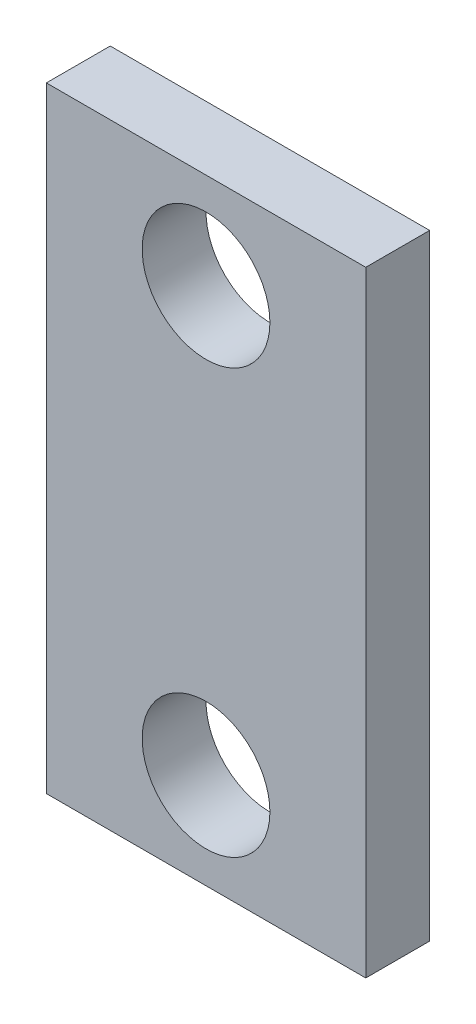
from build123d import *

# Parameters (mm, degrees)
IZIM1_W                     = 10
IZIM1_H                     = 19.27
IZIM1_R                     = 2
Y_KSEKLIK_EKSTR_ZYON1_DEPTH = 2


with BuildPart() as part:
    # Çizim1 → Yükseklik-Ekstrüzyon1 (new body)
    with BuildSketch(Plane.XY):
        with Locations((5, 9.635)):
            Rectangle(IZIM1_W, IZIM1_H)
        with Locations((4.999077783, 16.27)):
            Circle(IZIM1_R, mode=Mode.SUBTRACT)
        with Locations((4.999077783, 3)):
            Circle(IZIM1_R, mode=Mode.SUBTRACT)
    extrude(amount=Y_KSEKLIK_EKSTR_ZYON1_DEPTH)


solid = part.part
